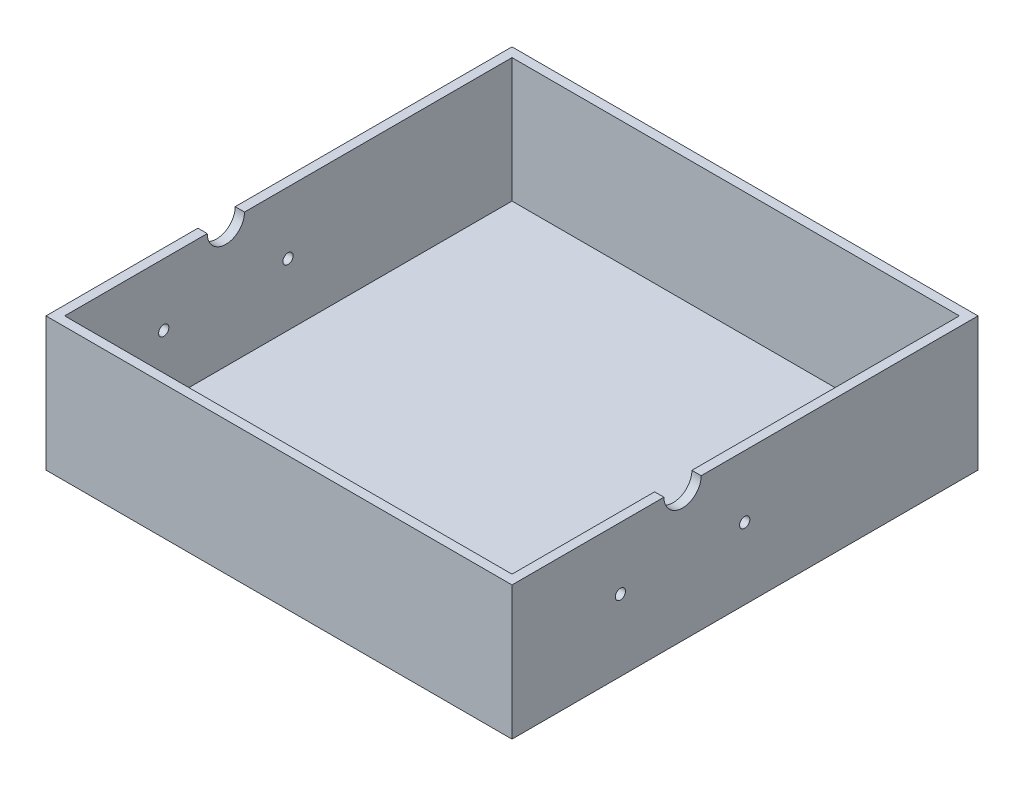
from build123d import *

# Parameters (mm, degrees)
SKETCH_1_W          = 150
SKETCH_1_H          = 150
EXTRUDE_1_DEPTH     = 3
SKETCH_2_W          = 150
SKETCH_2_H          = 150
SKETCH_2_W_2        = 144
SKETCH_2_H_2        = 144
EXTRUDE_2_DEPTH     = 40
SKETCH_3_R          = 6
SKETCH_3_R_2        = 1.65
CUT_EXTRUDE_1_DEPTH = 174.130008953


with BuildPart() as part:
    # 草图1 → 凸台-拉伸1 (new body)
    with BuildSketch(Plane(origin=(0, 0, 0), x_dir=(1, 0, 0), z_dir=(0, 1, 0))):
        Rectangle(SKETCH_1_W, SKETCH_1_H)
    extrude(amount=EXTRUDE_1_DEPTH)

    # 草图2 → 凸台-拉伸2 (add)
    with BuildSketch(Plane(origin=(0, 3, 0), x_dir=(1, 0, 0), z_dir=(0, 1, 0))):
        Rectangle(SKETCH_2_W, SKETCH_2_H)
        Rectangle(SKETCH_2_W_2, SKETCH_2_H_2, mode=Mode.SUBTRACT)
    extrude(amount=EXTRUDE_2_DEPTH)

    # 草图3 → 切除-拉伸1 (cut, through all)
    with BuildSketch(Plane(origin=(75, 0, 0), x_dir=(0, 0, -1), z_dir=(1, 0, 0))):
        with Locations((-20.1, 43)):
            Circle(SKETCH_3_R)
        with Locations((-0.1, 23)):
            Circle(SKETCH_3_R_2)
        with Locations((-40.1, 23)):
            Circle(SKETCH_3_R_2)
    extrude(amount=-CUT_EXTRUDE_1_DEPTH, mode=Mode.SUBTRACT)


solid = part.part
